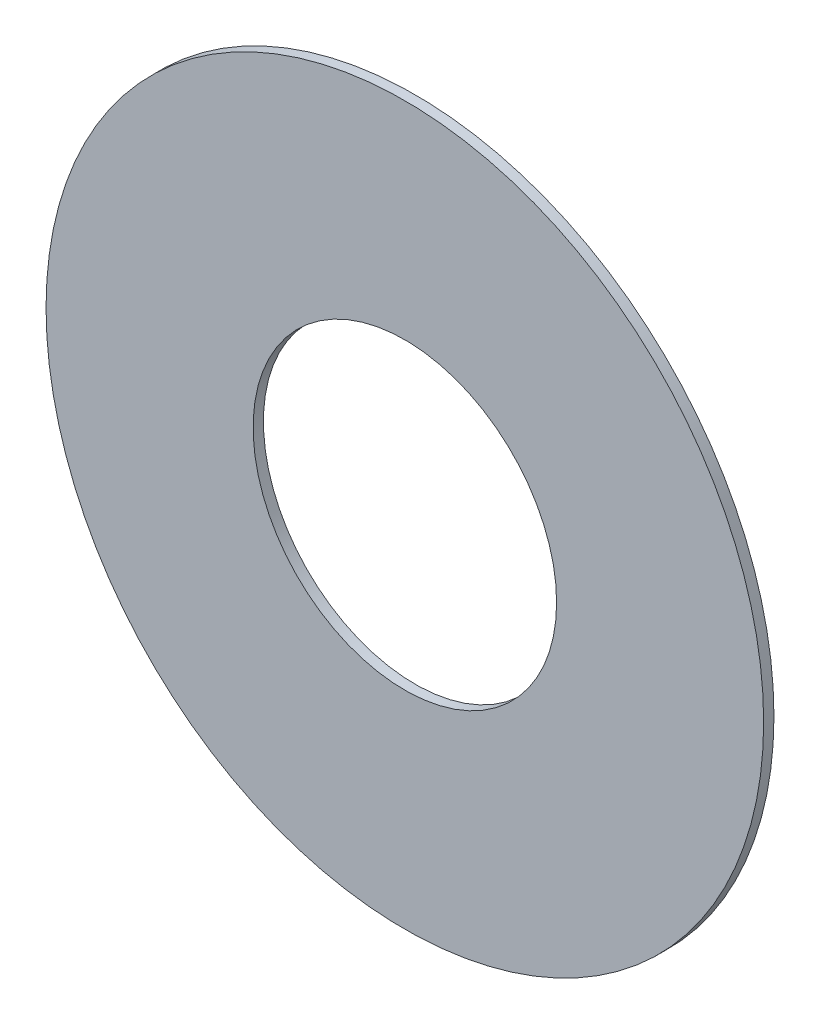
from build123d import *

# Parameters (mm, degrees)
PRINTED_GUARD_START = 40.5
SKETCH_1_R          = 69.753846154
SKETCH_1_R_2        = 29.5
PRINTED_GUARD_DEPTH = 2


with BuildPart() as part:
    # Эскиз1 → Printed_guard (new body)
    with BuildSketch(Plane.XY.offset(PRINTED_GUARD_START)):
        Circle(SKETCH_1_R)
        Circle(SKETCH_1_R_2, mode=Mode.SUBTRACT)
    extrude(amount=PRINTED_GUARD_DEPTH)


solid = part.part
